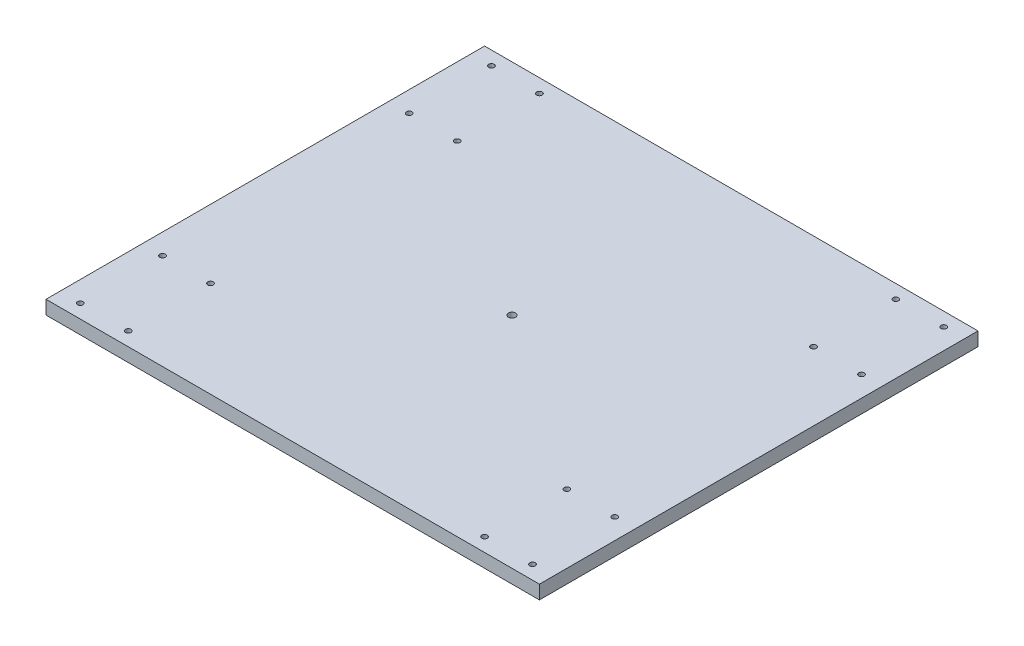
from build123d import *

# Parameters (mm, degrees)
SKETCH1_W                        = 457.2
SKETCH1_H                        = 406.4
BOSS_EXTRUDE1_DEPTH              = 12.7
F_1_4_20_TAPPED_HOLE1_AT_2_COUNT = 2
F_1_4_20_TAPPED_HOLE1_AT_2_PITCH = 76.2
F_1_4_20_TAPPED_HOLE1_AT_3_COUNT = 2
F_1_4_20_TAPPED_HOLE1_AT_3_PITCH = 88.217019333
F_1_4_20_TAPPED_HOLE1_AT_4_COUNT = 2
F_1_4_20_TAPPED_HOLE1_AT_4_PITCH = 44.45
F_1_4_CLEARANCE_HOLE1_D          = 6.7564


with BuildPart() as part:
    # Sketch1 → Boss-Extrude1 (new body)
    with BuildSketch(Plane(origin=(0, 0, 0), x_dir=(1, 0, 0), z_dir=(0, 1, 0))):
        Rectangle(SKETCH1_W, SKETCH1_H)
    extrude(amount=BOSS_EXTRUDE1_DEPTH)

    # Sketch4 → 1/4-20 Tapped Hole1 (revolve, cut)
    with BuildSketch(Plane(origin=(-209.55, 12.7, 190.5), x_dir=(0, 0, 1), z_dir=(1, 0, 0))):
        Polygon((0, 0), (0, 18.043816902), (2.5527, 16.51), (2.5527, 0), align=None)
    f_1_4_20_tapped_hole1 = revolve(axis=Axis((-209.55, 19.05, 190.5), (0, -1, 0)), mode=Mode.SUBTRACT)

    # 1/4-20 Tapped Hole1 at 2: 1/4-20 Tapped Hole1 ×2
    with Locations(*[(0, 0, -i * F_1_4_20_TAPPED_HOLE1_AT_2_PITCH) for i in range(1, F_1_4_20_TAPPED_HOLE1_AT_2_COUNT)]):
        add(f_1_4_20_tapped_hole1, mode=Mode.SUBTRACT)

    # 1/4-20 Tapped Hole1 at 3: 1/4-20 Tapped Hole1 ×2
    with Locations(*[Vector(0.5038710255240861, 0, -0.8637789008984336) * (i * F_1_4_20_TAPPED_HOLE1_AT_3_PITCH) for i in range(1, F_1_4_20_TAPPED_HOLE1_AT_3_COUNT)]):
        add(f_1_4_20_tapped_hole1, mode=Mode.SUBTRACT)

    # 1/4-20 Tapped Hole1 at 4: 1/4-20 Tapped Hole1 ×2
    with Locations(*[(i * F_1_4_20_TAPPED_HOLE1_AT_4_PITCH, 0, 0) for i in range(1, F_1_4_20_TAPPED_HOLE1_AT_4_COUNT)]):
        add(f_1_4_20_tapped_hole1, mode=Mode.SUBTRACT)

    # Mirror1: 1/4-20 Tapped Hole1 across plane
    add(f_1_4_20_tapped_hole1.mirror(Plane(origin=(0, 0, 0), x_dir=(0, 0, 1), z_dir=(1, 0, 0))), mode=Mode.SUBTRACT)

    # Mirror1 copy 1 sketch → Mirror1 copy 1 (revolve, cut)
    with BuildSketch(Plane(origin=(209.55, 12.7, 114.3), x_dir=(0, 0, 1), z_dir=(-1, 0, 0))):
        Polygon((0, 0), (0, -18.043816902), (2.5527, -16.51), (2.5527, 0), align=None)
    revolve(axis=Axis((209.55, 19.05, 114.3), (0, 1, 0)), mode=Mode.SUBTRACT)

    # Mirror1 copy 2 sketch → Mirror1 copy 2 (revolve, cut)
    with BuildSketch(Plane(origin=(165.1, 12.7, 114.3), x_dir=(0, 0, 1), z_dir=(-1, 0, 0))):
        Polygon((0, 0), (0, -18.043816902), (2.5527, -16.51), (2.5527, 0), align=None)
    revolve(axis=Axis((165.1, 19.05, 114.3), (0, 1, 0)), mode=Mode.SUBTRACT)

    # Mirror1 copy 3 sketch → Mirror1 copy 3 (revolve, cut)
    with BuildSketch(Plane(origin=(165.1, 12.7, 190.5), x_dir=(0, 0, 1), z_dir=(-1, 0, 0))):
        Polygon((0, 0), (0, -18.043816902), (2.5527, -16.51), (2.5527, 0), align=None)
    revolve(axis=Axis((165.1, 19.05, 190.5), (0, 1, 0)), mode=Mode.SUBTRACT)

    # Mirror2: 1/4-20 Tapped Hole1 across plane
    add(f_1_4_20_tapped_hole1.mirror(Plane.XY), mode=Mode.SUBTRACT)

    # Mirror2 copy 1 sketch → Mirror2 copy 1 (revolve, cut)
    with BuildSketch(Plane(origin=(-209.55, 12.7, -114.3), x_dir=(0, 0, -1), z_dir=(1, 0, 0))):
        Polygon((0, 0), (0, -18.043816902), (2.5527, -16.51), (2.5527, 0), align=None)
    revolve(axis=Axis((-209.55, 19.05, -114.3), (0, 1, 0)), mode=Mode.SUBTRACT)

    # Mirror2 copy 2 sketch → Mirror2 copy 2 (revolve, cut)
    with BuildSketch(Plane(origin=(-165.1, 12.7, -114.3), x_dir=(0, 0, -1), z_dir=(1, 0, 0))):
        Polygon((0, 0), (0, -18.043816902), (2.5527, -16.51), (2.5527, 0), align=None)
    revolve(axis=Axis((-165.1, 19.05, -114.3), (0, 1, 0)), mode=Mode.SUBTRACT)

    # Mirror2 copy 3 sketch → Mirror2 copy 3 (revolve, cut)
    with BuildSketch(Plane(origin=(-165.1, 12.7, -190.5), x_dir=(0, 0, -1), z_dir=(1, 0, 0))):
        Polygon((0, 0), (0, -18.043816902), (2.5527, -16.51), (2.5527, 0), align=None)
    revolve(axis=Axis((-165.1, 19.05, -190.5), (0, 1, 0)), mode=Mode.SUBTRACT)

    # Mirror2 copy 4 sketch → Mirror2 copy 4 (revolve, cut)
    with BuildSketch(Plane(origin=(209.55, 12.7, -190.5), x_dir=(0, 0, -1), z_dir=(-1, 0, 0))):
        Polygon((0, 0), (0, 18.043816902), (2.5527, 16.51), (2.5527, 0), align=None)
    revolve(axis=Axis((209.55, 19.05, -190.5), (0, -1, 0)), mode=Mode.SUBTRACT)

    # Mirror2 copy 5 sketch → Mirror2 copy 5 (revolve, cut)
    with BuildSketch(Plane(origin=(209.55, 12.7, -114.3), x_dir=(0, 0, -1), z_dir=(-1, 0, 0))):
        Polygon((0, 0), (0, 18.043816902), (2.5527, 16.51), (2.5527, 0), align=None)
    revolve(axis=Axis((209.55, 19.05, -114.3), (0, -1, 0)), mode=Mode.SUBTRACT)

    # Mirror2 copy 6 sketch → Mirror2 copy 6 (revolve, cut)
    with BuildSketch(Plane(origin=(165.1, 12.7, -114.3), x_dir=(0, 0, -1), z_dir=(-1, 0, 0))):
        Polygon((0, 0), (0, 18.043816902), (2.5527, 16.51), (2.5527, 0), align=None)
    revolve(axis=Axis((165.1, 19.05, -114.3), (0, -1, 0)), mode=Mode.SUBTRACT)

    # Mirror2 copy 7 sketch → Mirror2 copy 7 (revolve, cut)
    with BuildSketch(Plane(origin=(165.1, 12.7, -190.5), x_dir=(0, 0, -1), z_dir=(-1, 0, 0))):
        Polygon((0, 0), (0, 18.043816902), (2.5527, 16.51), (2.5527, 0), align=None)
    revolve(axis=Axis((165.1, 19.05, -190.5), (0, -1, 0)), mode=Mode.SUBTRACT)

    # 1/4 Clearance Hole1 (through all)
    with Locations(Plane(origin=(0, 12.7, 0), x_dir=(1, 0, 0), z_dir=(0, 1, 0))):
        with Locations((0, 0)):
            Hole(F_1_4_CLEARANCE_HOLE1_D / 2)


solid = part.part
